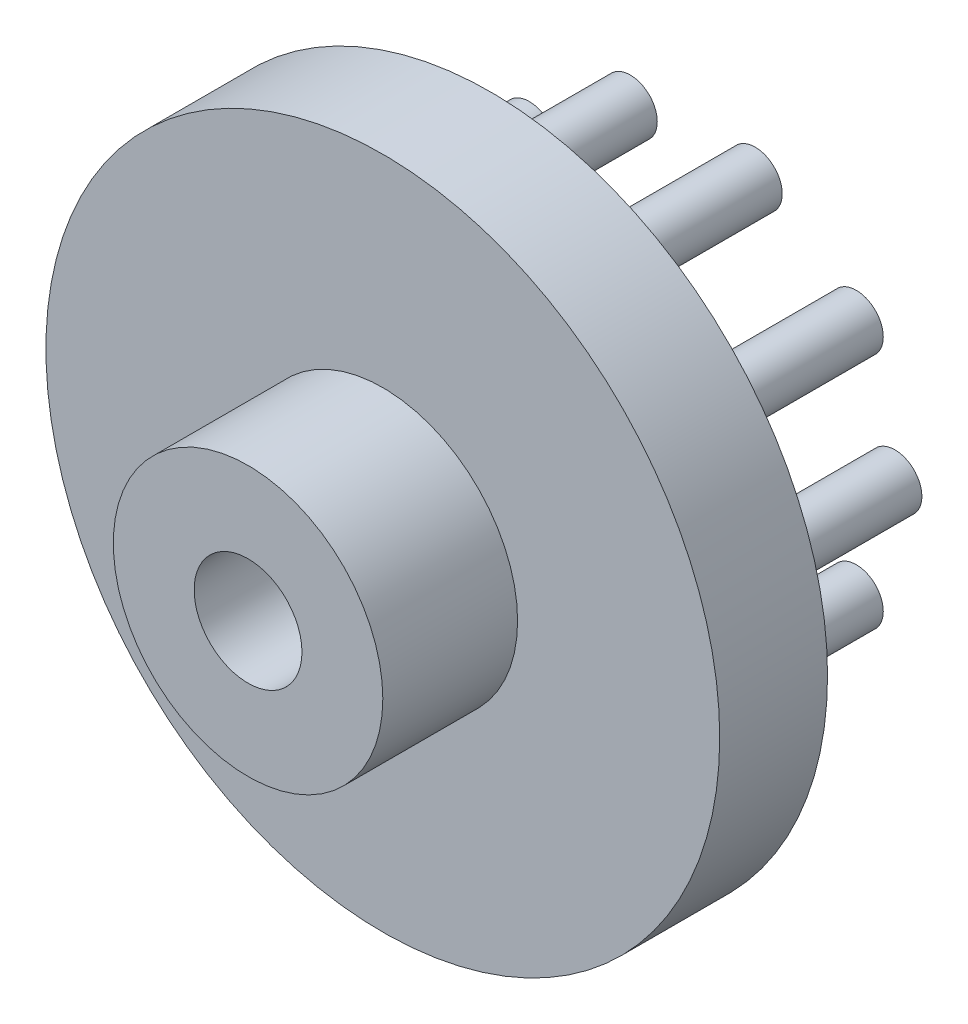
from build123d import *
from build123d.topology import SkipClean

# Parameters (mm, degrees)
SKETCH1_R               = 25
BOSS_EXTRUDE1_DEPTH     = 8
SKETCH2_R               = 2
BOSS_EXTRUDE2_DEPTH     = 15
CUT_EXTRUDE1_DEPTH      = 39.405728739
CUT_EXTRUDE1_DEPTH_BACK = 39.405728739
SKETCH3_R               = 4
SKETCH4_R               = 10
SKETCH4_R_2             = 4
BOSS_EXTRUDE3_DEPTH     = 10


with BuildPart() as part:
    # Sketch1 → Boss-Extrude1 (new body)
    with BuildSketch(Plane.XY):
        Circle(SKETCH1_R)
    extrude(amount=BOSS_EXTRUDE1_DEPTH)

    # Sketch2 → Boss-Extrude2 (add)
    with BuildSketch(Plane(origin=(0, 0, 0), x_dir=(-1, 0, 0), z_dir=(0, 0, -1))):
        with Locations((15, 0)):
            Circle(SKETCH2_R)
        with Locations((12.135254916, -8.816778784)):
            Circle(SKETCH2_R)
        with Locations((4.635254916, -14.265847744)):
            Circle(SKETCH2_R)
        with Locations((-4.635254916, -14.265847744)):
            Circle(SKETCH2_R)
        with Locations((-12.135254916, -8.816778784)):
            Circle(SKETCH2_R)
        with Locations((-15, 0)):
            Circle(SKETCH2_R)
        with Locations((-12.135254916, 8.816778784)):
            Circle(SKETCH2_R)
        with Locations((-4.635254916, 14.265847744)):
            Circle(SKETCH2_R)
        with Locations((4.635254916, 14.265847744)):
            Circle(SKETCH2_R)
        with Locations((12.135254916, 8.816778784)):
            Circle(SKETCH2_R)
    extrude(amount=BOSS_EXTRUDE2_DEPTH)

    # Sketch3 → Cut-Extrude1 (cut, two sides: drawn at the far end of the back side and taken through both)
    with BuildSketch(Plane(origin=(0, 0, 0), x_dir=(-1, 0, 0), z_dir=(0, 0, -1)).offset(-CUT_EXTRUDE1_DEPTH_BACK)):
        Circle(SKETCH3_R)
    extrude(amount=CUT_EXTRUDE1_DEPTH + CUT_EXTRUDE1_DEPTH_BACK, mode=Mode.SUBTRACT)

    # Sketch4 → Boss-Extrude3 (add)
    with SkipClean():  # the faces are left unmerged after this step: merging them gives an invalid solid
        with BuildSketch(Plane.XY.offset(8)):
            Circle(SKETCH4_R)
            Circle(SKETCH4_R_2, mode=Mode.SUBTRACT)
        extrude(amount=BOSS_EXTRUDE3_DEPTH)


solid = part.part
